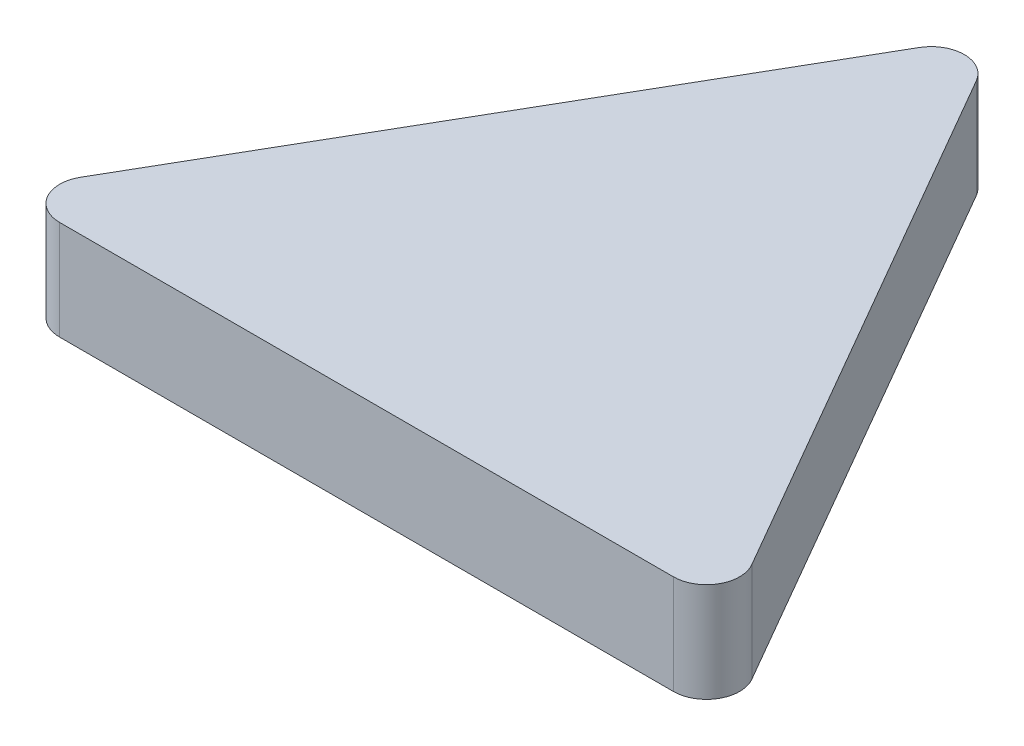
from build123d import *

# Parameters (mm, degrees)
BOSS_EXTRUDE1_DEPTH = 19.05


with BuildPart() as part:
    # Sketch1 → Boss-Extrude1 (new body)
    with BuildSketch(Plane(origin=(0, 0, 0), x_dir=(1, 0, 0), z_dir=(0, 1, 0))):
        with BuildLine():
            Line((-5.499261314, 71.130832606), (-64.350738686, -30.802916303))
            ThreePointArc((-64.350738686, -30.802916303), (-64.350738686, -37.152916303), (-58.851477372, -40.327916303))
            Line((-58.851477372, -40.327916303), (58.851477372, -40.327916303))
            ThreePointArc((58.851477372, -40.327916303), (64.350738686, -37.152916303), (64.350738686, -30.802916303))
            Line((64.350738686, -30.802916303), (5.499261314, 71.130832606))
            ThreePointArc((5.499261314, 71.130832606), (0, 74.305832606), (-5.499261314, 71.130832606))
        make_face()
    extrude(amount=BOSS_EXTRUDE1_DEPTH)


solid = part.part
